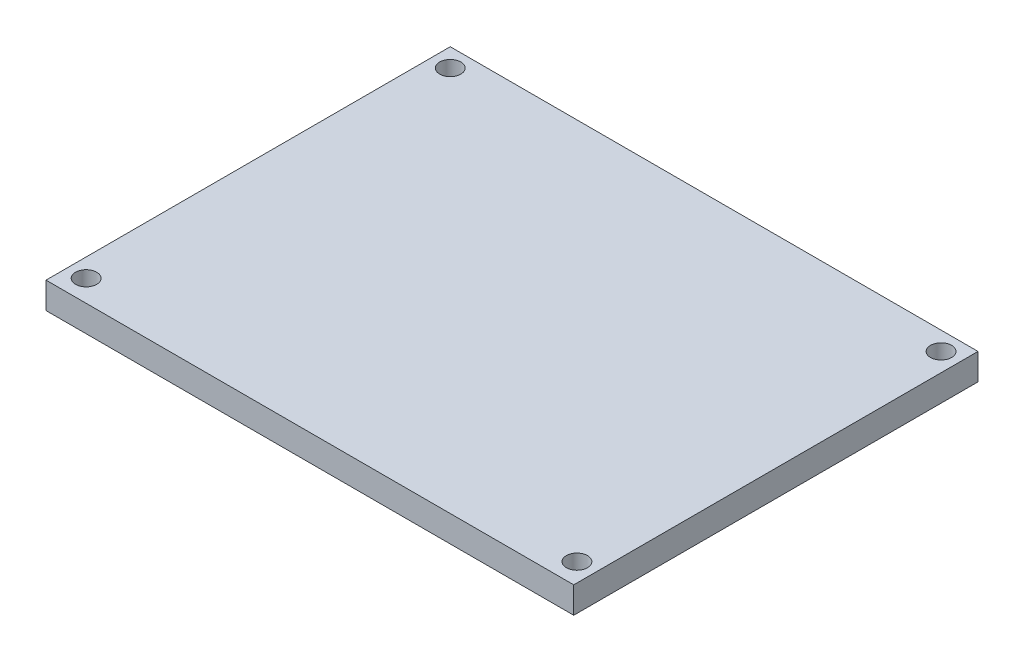
from build123d import *

# Parameters (mm, degrees)
SKETCH1_W           = 100
SKETCH1_H           = 76.6
BOSS_EXTRUDE1_DEPTH = 5
SKETCH2_R           = 2
CUT_EXTRUDE3_DEPTH  = 10
SKETCH3_R           = 2
CUT_EXTRUDE4_DEPTH  = 10


with BuildPart() as part:
    # Sketch1 → Boss-Extrude1 (new body)
    with BuildSketch(Plane(origin=(0, 0, 0), x_dir=(1, 0, 0), z_dir=(0, 1, 0))):
        Rectangle(SKETCH1_W, SKETCH1_H)
    extrude(amount=BOSS_EXTRUDE1_DEPTH)

    # Sketch2 → Cut-Extrude3 (cut)
    with BuildSketch(Plane(origin=(0, 5, 0), x_dir=(1, 0, 0), z_dir=(0, 1, 0))):
        with Locations(Location((-46.5, 34.8, 0), (0, 0, 270))):
            Circle(SKETCH2_R)
        with Locations(Location((46.5, 34.8, 0), (0, 0, 270))):
            Circle(SKETCH2_R)
    extrude(amount=-CUT_EXTRUDE3_DEPTH, mode=Mode.SUBTRACT)

    # Sketch3 → Cut-Extrude4 (cut)
    with BuildSketch(Plane(origin=(0, 5, 0), x_dir=(1, 0, 0), z_dir=(0, 1, 0))):
        with Locations(Location((-46.5, -34.2, 0), (0, 0, 270))):
            Circle(SKETCH3_R)
        with Locations(Location((46.5, -34.2, 0), (0, 0, 270))):
            Circle(SKETCH3_R)
    extrude(amount=-CUT_EXTRUDE4_DEPTH, mode=Mode.SUBTRACT)


solid = part.part
